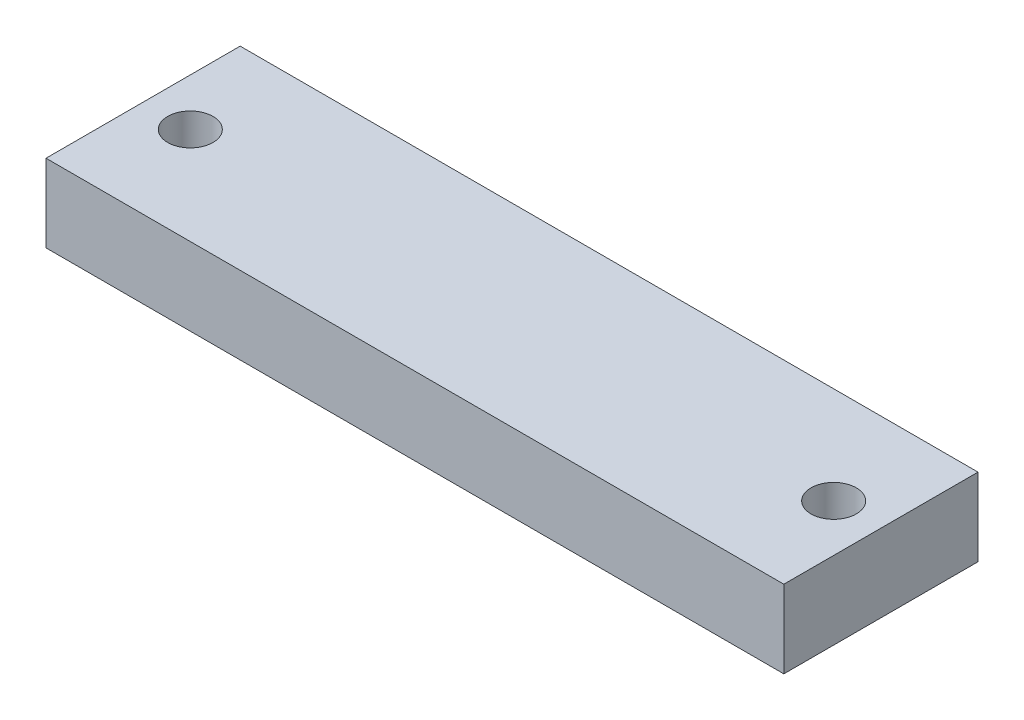
from build123d import *

# Parameters (mm, degrees)
SKETCH1_W           = 57
SKETCH1_H           = 15
SKETCH1_R           = 1.75
BOSS_EXTRUDE1_DEPTH = 6


with BuildPart() as part:
    # Sketch1 → Boss-Extrude1 (new body)
    with BuildSketch(Plane(origin=(0, 0, 0), x_dir=(1, 0, 0), z_dir=(0, 1, 0))):
        with Locations((28.5, -7.5)):
            Rectangle(SKETCH1_W, SKETCH1_H)
        with Locations(Location((3.65, -7.5, 0), (0, 0, 270))):
            Circle(SKETCH1_R, mode=Mode.SUBTRACT)
        with Locations(Location((53.35, -7.5, 0), (0, 0, 270))):
            Circle(SKETCH1_R, mode=Mode.SUBTRACT)
    extrude(amount=BOSS_EXTRUDE1_DEPTH)


solid = part.part
